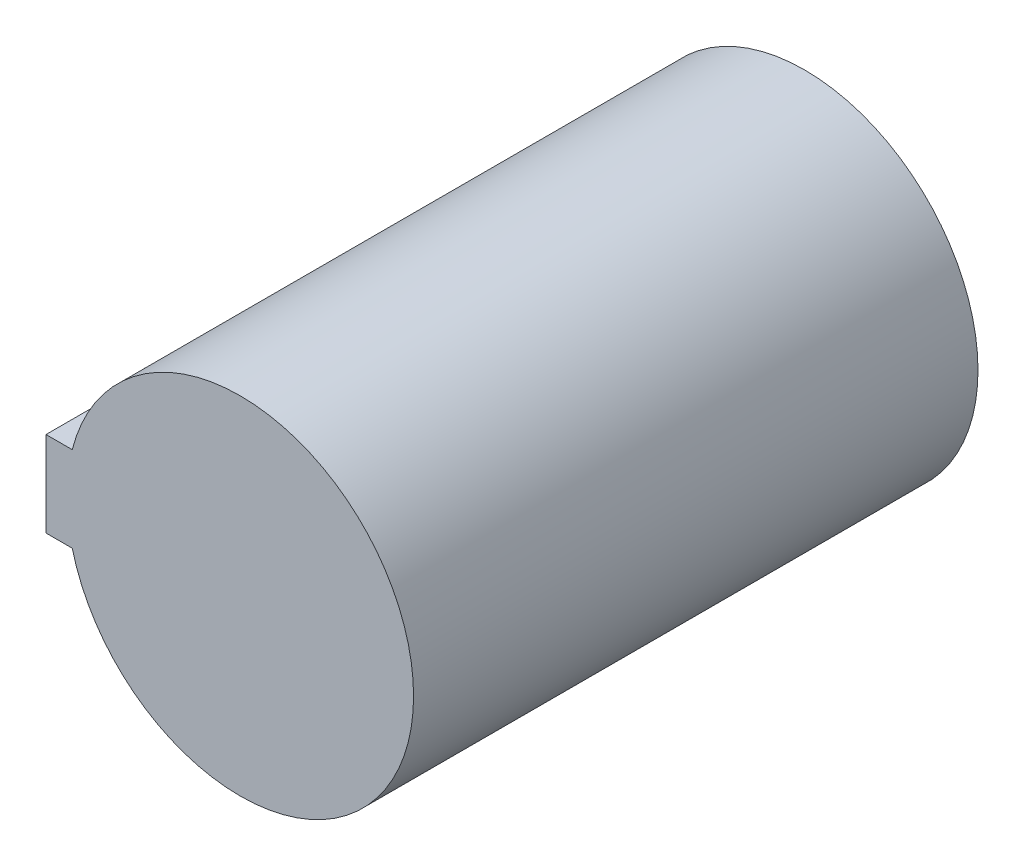
from build123d import *

# Parameters (mm, degrees)
BOSS_EXTRUDE1_DEPTH = 25
BOSS_EXTRUDE3_START = 39.8
SKETCH2_R           = 19.9
BOSS_EXTRUDE3_DEPTH = 39.8


with BuildPart() as part:
    # Sketch1 → Boss-Extrude1 (new body)
    with BuildSketch(Plane(origin=(0, 0, 0), x_dir=(0, 1, 0), z_dir=(0, 0, 1))):
        with BuildLine():
            Line((-4.9, 22.3), (4.9, 22.3))
            Line((4.9, 22.3), (4.9, 19.287301522))
            ThreePointArc((4.9, 19.287301522), (0, -19.9), (-4.9, 19.287301522))
            Line((-4.9, 19.287301522), (-4.9, 22.3))
        make_face()
    extrude(amount=BOSS_EXTRUDE1_DEPTH)

    # Sketch2 → Boss-Extrude3 (add)
    with BuildSketch(Plane(origin=(0, 0, 0), x_dir=(1, 0, 0), z_dir=(0, 0, -1)).offset(BOSS_EXTRUDE3_START)):
        with Locations(Location((0, 0, 0), (0, 0, 180))):
            Circle(SKETCH2_R)
    extrude(amount=-BOSS_EXTRUDE3_DEPTH)


solid = part.part
